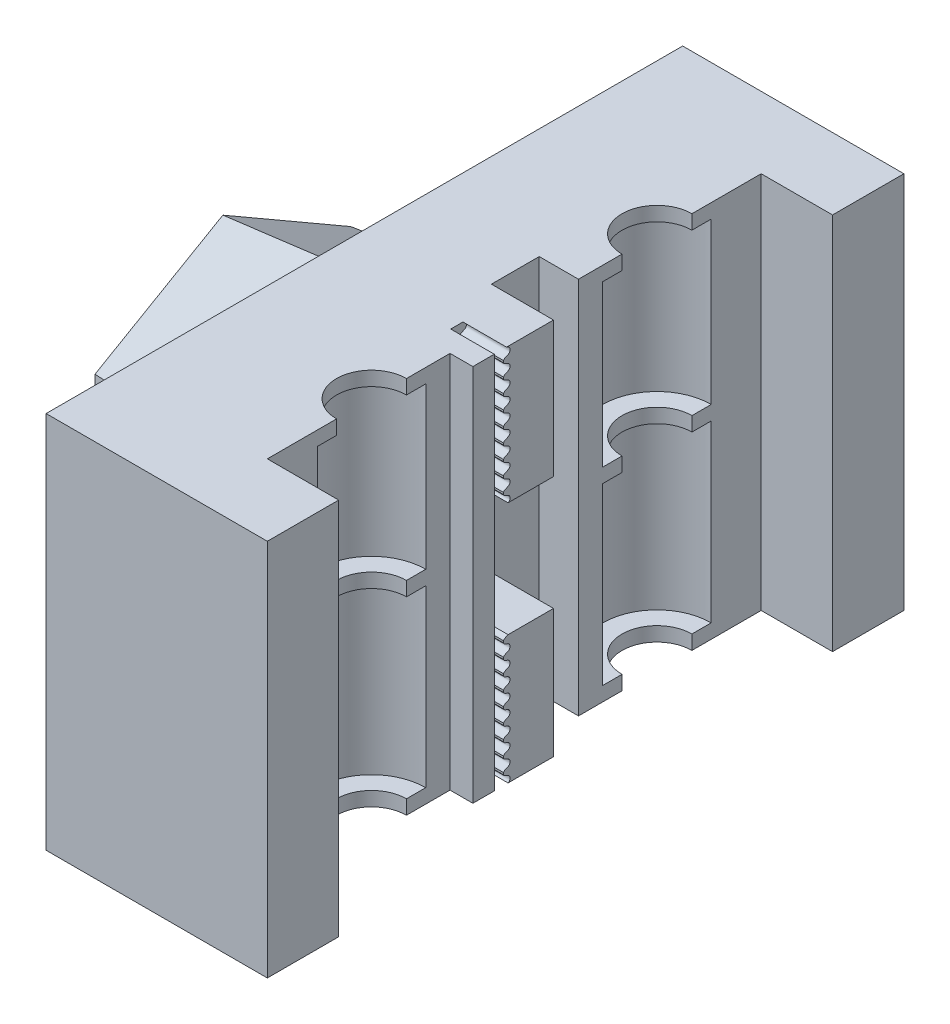
from build123d import *

# Parameters (mm, degrees)
BOSS_EXTRUDE1_DEPTH  = 53
BOSS_EXTRUDE2_DEPTH  = 2
BOSS_EXTRUDE3_DEPTH  = 2
BOSS_EXTRUDE4_DEPTH  = 2
SKETCH7_W            = 3.2
SKETCH7_H            = 2
BOSS_EXTRUDE5_DEPTH  = 53
SKETCH8_W            = 8.7
SKETCH8_H            = 3
SKETCH8_H_2          = 7
BOSS_EXTRUDE6_DEPTH  = 53
CUT_EXTRUDE4_DEPTH   = 8.7
LPATTERN1_COUNT      = 24
LPATTERN1_PITCH      = 2
LPATTERN1_COL_COUNT  = 4
LPATTERN1_COL_PITCH  = 2
SKETCH12_W           = 7
SKETCH12_H           = 16
CUT_EXTRUDE5_DEPTH   = 8.7
BOSS_EXTRUDE16_REACH = 80.249
SKETCH13_W           = 2.594079443
SKETCH13_H           = 4.169020651
SKETCH14_W           = 3.2
SKETCH14_H           = 2
CUT_EXTRUDE6_DEPTH   = 53
SKETCH16_W           = 4.169020651
SKETCH16_H           = 16
CUT_EXTRUDE7_DEPTH   = 2.594079443


with BuildPart() as part:
    # Sketch1 → Boss-Extrude1 (new body)
    with BuildSketch(Plane(origin=(0, 0, 0), x_dir=(1, 0, 0), z_dir=(0, 1, 0))):
        with BuildLine():
            Line((0, 36.6), (0, 43.6))
            Line((0, 43.6), (10, 43.6))
            Line((10, 43.6), (10, 53.6))
            Line((10, 53.6), (-21, 53.6))
            Line((-21, 53.6), (-21, -35.6))
            Line((-21, -35.6), (10, -35.6))
            Line((10, -35.6), (10, -25.6))
            Line((10, -25.6), (0, -25.6))
            Line((0, -25.6), (0, -18.6))
            ThreePointArc((0, -18.6), (-7.6, -11), (0, -3.4))
            Line((0, -3.4), (0, 0))
            Line((0, 0), (-5.5, 0))
            Line((-5.5, 0), (-5.5, 18))
            Line((-5.5, 18), (0, 18))
            Line((0, 18), (0, 21.4))
            ThreePointArc((0, 21.4), (-7.6, 29), (0, 36.6))
        make_face()
    extrude(amount=BOSS_EXTRUDE1_DEPTH)

    # Sketch2 → Boss-Extrude2 (add)
    with BuildSketch(Plane.XZ):
        with BuildLine():
            Line((0, 18.6), (0, 15.9))
            ThreePointArc((0, 15.9), (-4.9, 11), (0, 6.1))
            Line((0, 6.1), (0, 3.4))
            ThreePointArc((0, 3.4), (-7.6, 11), (0, 18.6))
        make_face()
        with BuildLine():
            Line((0, -21.4), (0, -24.102006986))
            ThreePointArc((0, -24.102006986), (-4.897993014, -29), (0, -33.897993014))
            Line((0, -33.897993014), (0, -36.6))
            ThreePointArc((0, -36.6), (-7.6, -29), (0, -21.4))
        make_face()
    extrude(amount=-BOSS_EXTRUDE2_DEPTH)

    # Sketch3 → Boss-Extrude3 (add)
    with BuildSketch(Plane(origin=(0, 26.5, 0), x_dir=(-1, 0, 0), z_dir=(0, -1, 0))):
        with BuildLine():
            Line((0, -3.4), (0, -6.1))
            ThreePointArc((0, -6.1), (4.9, -11), (0, -15.9))
            Line((0, -15.9), (0, -18.6))
            ThreePointArc((0, -18.6), (7.6, -11), (0, -3.4))
        make_face()
        with BuildLine():
            Line((0, 21.4), (0, 24.1))
            ThreePointArc((0, 24.1), (4.9, 29), (0, 33.9))
            Line((0, 33.9), (0, 36.6))
            ThreePointArc((0, 36.6), (7.6, 29), (0, 21.4))
        make_face()
    extrude(amount=-BOSS_EXTRUDE3_DEPTH)

    # Sketch4 → Boss-Extrude4 (add)
    with BuildSketch(Plane(origin=(0, 51, 0), x_dir=(-1, 0, 0), z_dir=(0, -1, 0))):
        with BuildLine():
            Line((0, -18.6), (0, -15.9))
            ThreePointArc((0, -15.9), (4.9, -11), (0, -6.1))
            Line((0, -6.1), (0, -3.4))
            ThreePointArc((0, -3.4), (7.6, -11), (0, -18.6))
        make_face()
        with BuildLine():
            Line((0, 36.6), (0, 33.9))
            ThreePointArc((0, 33.9), (4.9, 29), (0, 24.1))
            Line((0, 24.1), (0, 21.4))
            ThreePointArc((0, 21.4), (7.6, 29), (0, 36.6))
        make_face()
    extrude(amount=-BOSS_EXTRUDE4_DEPTH)

    # Sketch7 → Boss-Extrude5 (add)
    with BuildSketch(Plane(origin=(0, 53, 0), x_dir=(1, 0, 0), z_dir=(0, 1, 0))):
        with Locations((1.6, -1)):
            Rectangle(SKETCH7_W, SKETCH7_H)
    extrude(amount=-BOSS_EXTRUDE5_DEPTH)

    # Sketch8 → Boss-Extrude6 (add)
    with BuildSketch(Plane(origin=(0, 53, 0), x_dir=(1, 0, 0), z_dir=(0, 1, 0))):
        with Locations((-1.15, 1.5)):
            Rectangle(SKETCH8_W, SKETCH8_H)
        with Locations((-1.15, 7.8)):
            Rectangle(SKETCH8_W, SKETCH8_H_2)
    extrude(amount=-BOSS_EXTRUDE6_DEPTH)

    # Sketch11 → Cut-Extrude4 (cut)
    with BuildSketch(Plane(origin=(3.2, 0, 0), x_dir=(0, 0, -1), z_dir=(1, 0, 0))):
        with BuildLine():
            Line((4.3, 47.306239619), (4.3, 45.569818597))
            add(Edge.make_bspline(
                [(4.3, 47.306239619), (4.304585671, 47.289689378), (4.3205234, 47.245302086), (4.371187464, 47.170773911), (4.477078697, 47.101170886), (4.604073268, 47.05438594), (4.721377885, 46.99713352), (4.825385829, 46.947432948), (4.924110578, 46.904687552), (5.018626137, 46.852511072), (5.108648129, 46.778296095), (5.15607818, 46.681619296), (5.190529888, 46.592603511), (5.191346872, 46.519529121), (5.193134848, 46.456137941), (5.189134979, 46.382933066), (5.187052273, 46.2870515), (5.139920256, 46.170937817), (5.049433419, 46.05704295), (4.908650786, 45.985589234), (4.755373788, 45.916019055), (4.621045426, 45.852918244), (4.507485633, 45.800421351), (4.412155305, 45.756237133), (4.335588319, 45.676206789), (4.308791101, 45.606289517), (4.3, 45.569818597)],
                knots=[0.051147154, 0.051147154, 0.051147154, 0.051147154, 0.068471507, 0.098589582, 0.140403267, 0.193950507, 0.235463377, 0.272242123, 0.31054318, 0.344117088, 0.381404375, 0.426159519, 0.451184085, 0.477134734, 0.499165141, 0.51543248, 0.551275289, 0.595352972, 0.639475819, 0.695379202, 0.75212591, 0.810504395, 0.845135106, 0.878871382, 0.916022594, 0.953547895, 0.953547895, 0.953547895, 0.953547895], degree=3))
        make_face()
    cut_extrude4 = extrude(amount=-CUT_EXTRUDE4_DEPTH, mode=Mode.SUBTRACT)

    # LPattern1: Cut-Extrude4 ×24
    with Locations(*[(0, -i * LPATTERN1_PITCH, 0) for i in range(1, LPATTERN1_COUNT)]):
        add(cut_extrude4, mode=Mode.SUBTRACT)

    # LPattern1 col: Cut-Extrude4 ×4
    with Locations(*[(0, i * LPATTERN1_COL_PITCH, 0) for i in range(1, LPATTERN1_COL_COUNT)]):
        add(cut_extrude4, mode=Mode.SUBTRACT)

    # Sketch12 → Cut-Extrude5 (cut)
    with BuildSketch(Plane(origin=(3.2, 0, 0), x_dir=(0, 0, -1), z_dir=(1, 0, 0))):
        with Locations((7.8, 26)):
            Rectangle(SKETCH12_W, SKETCH12_H)
    extrude(amount=-CUT_EXTRUDE5_DEPTH, mode=Mode.SUBTRACT)

    # Boss-Extrude16: up to this face of the body (flat: up to its plane)
    boss_extrude16_end = Plane(part.part.faces().sort_by_distance((-9.22297316, 0, -8.844973624))[0])
    # Sketch13 → Boss-Extrude16 (add, up to the picked face)
    with BuildSketch(Plane(origin=(0, 53, 0), x_dir=(1, 0, 0), z_dir=(0, 1, 0)), mode=Mode.PRIVATE) as boss_extrude16_sk1:
        with Locations((-4.202960278, 5.084510326)):
            Rectangle(SKETCH13_W, SKETCH13_H)
    boss_extrude16_tool1 = split(extrude(boss_extrude16_sk1.sketch, amount=-BOSS_EXTRUDE16_REACH, mode=Mode.PRIVATE), bisect_by=boss_extrude16_end, keep=Keep.BOTH, mode=Mode.PRIVATE)
    add(boss_extrude16_tool1.solids().sort_by(Axis((-4.20296, 53, -5.08451), (0, -1, 0)))[0])

    # Sketch14 → Cut-Extrude6 (cut)
    with BuildSketch(Plane(origin=(0, 53, 0), x_dir=(1, 0, 0), z_dir=(0, 1, 0))):
        with Locations((1.6, -1)):
            Rectangle(SKETCH14_W, SKETCH14_H)
    extrude(amount=-CUT_EXTRUDE6_DEPTH, mode=Mode.SUBTRACT)

    # Sketch16 → Cut-Extrude7 (cut)
    with BuildSketch(Plane(origin=(-2.905920557, 0, 0), x_dir=(0, 0, -1), z_dir=(1, 0, 0))):
        with Locations((5.084510326, 26)):
            Rectangle(SKETCH16_W, SKETCH16_H)
    extrude(amount=-CUT_EXTRUDE7_DEPTH, mode=Mode.SUBTRACT)

    # Sketch15 → Loft1 section 0
    with BuildSketch(Plane.ZY.offset(21)):
        with BuildLine():
            Line((-7.169020651, 49), (-27.087604938, 37.5))
            Line((-27.087604938, 37.5), (-27.087604938, 14.5))
            Line((-27.087604938, 14.5), (-7.169020651, 3))
            Line((-7.169020651, 3), (12.749563636, 14.5))
            Line((12.749563636, 14.5), (12.749563636, 37.5))
            Line((12.749563636, 37.5), (-7.169020651, 49))
        make_face()
    # Sketch18 → Loft1 section 1
    with BuildSketch(Plane.ZY.offset(39)):
        with BuildLine():
            Line((-7.169020651, 46.690598923), (-25.087604938, 36.345299462))
            Line((-25.087604938, 36.345299462), (-25.087604938, 15.654700538))
            Line((-25.087604938, 15.654700538), (-7.169020651, 5.309401077))
            Line((-7.169020651, 5.309401077), (10.749563636, 15.654700538))
            Line((10.749563636, 15.654700538), (10.749563636, 36.345299462))
            Line((10.749563636, 36.345299462), (-7.169020651, 46.690598923))
        make_face()
    loft()


solid = part.part
